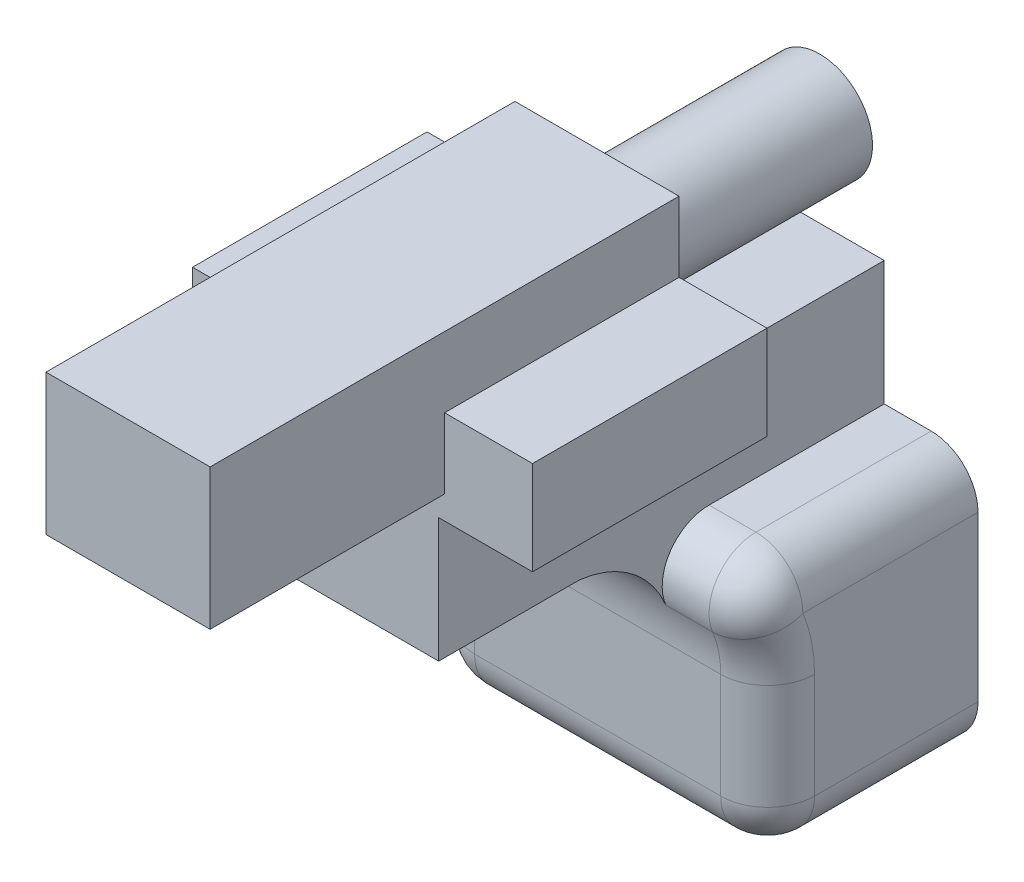
from build123d import *

# Parameters (mm, degrees)
BOSS_EXTRUDE1_DEPTH = 10
SKETCH3_W           = 14.5
SKETCH3_H           = 11
CUT_EXTRUDE2_DEPTH  = 2
BOSS_EXTRUDE2_DEPTH = 10
SKETCH2_R           = 2.25
BOSS_EXTRUDE4_DEPTH = 9
CUT_EXTRUDE5_DEPTH  = 28.596014205
FILLET1_R           = 2


with BuildPart() as part:
    # Sketch1 → Boss-Extrude1 (new body)
    with BuildSketch(Plane.XY):
        Polygon((2.75, 0), (2.75, 5.3), (6.75, 5.3), (6.75, 9.3), (3, 9.3), (3, 12.3), (-4, 12.3), (-4, 9.3), (-7.75, 9.3), (-7.75, 5.3), (-3.75, 5.3), (-3.75, 0), (-7.75, 0), (-7.75, -11), (6.75, -11), (6.75, 0), align=None)
    extrude(amount=BOSS_EXTRUDE1_DEPTH)

    # Sketch3 → Cut-Extrude2 (cut)
    with BuildSketch(Plane.XY.offset(10)):
        with Locations((-0.5, -5.5)):
            Rectangle(SKETCH3_W, SKETCH3_H)
    extrude(amount=-CUT_EXTRUDE2_DEPTH, mode=Mode.SUBTRACT)

    # Sketch4 → Boss-Extrude2 (add)
    with BuildSketch(Plane.XY.offset(10)):
        Polygon((3, 9.3), (3, 12.3), (-4, 12.3), (-4, 9.3), (-4, 6.3), (3, 6.3), align=None)
    extrude(amount=BOSS_EXTRUDE2_DEPTH)

    # Sketch2 → Boss-Extrude4 (add)
    with BuildSketch(Plane(origin=(0, 0, 0), x_dir=(-1, 0, 0), z_dir=(0, 0, -1))):
        with Locations((0, 9.3)):
            Circle(SKETCH2_R)
        Polygon((-2.75, 0), (-2.75, 5.3), (3.75, 5.3), (3.75, 0), (7.75, 0), (7.75, -11), (-6.75, -11), (-6.75, 0), align=None)
    extrude(amount=BOSS_EXTRUDE4_DEPTH)

    # Sketch6 → Cut-Extrude5 (cut, through all)
    with BuildSketch(Plane(origin=(6.75, 0, 0), x_dir=(0, 0, -1), z_dir=(1, 0, 0))):
        with BuildLine():
            Line((-4, 0), (-8, 0))
            Line((-8, 0), (-8, -11))
            Line((-8, -11), (0.027692569, -11))
            Line((0.027692569, -11), (0.027692569, -4.5))
            ThreePointArc((0.027692569, -4.5), (-1.12628941, -1.480384651), (-4, 0))
        make_face()
    extrude(amount=-CUT_EXTRUDE5_DEPTH, mode=Mode.SUBTRACT)

    # Fillet1
    fillet1_edges = [part.edges().sort_by_distance(p)[0] for p in [
        (6.75, 0, -2.5),
        (6.75, -11, -4.513846285),
        (-7.75, -11, -4.513846285),
        (-7.75, 0, -2.5),
        (6.75, -1.480384651, 1.12628941),
        (-5.75, 0, 4),
        (4.75, 0, 4),
        (6.75, -7.75, -0.027692569),
        (-0.5, -11, -0.027692569),
        (-7.75, -1.480384651, 1.12628941),
        (-7.75, -7.75, -0.027692569),
    ]]
    fillet(fillet1_edges, radius=FILLET1_R)


solid = part.part
